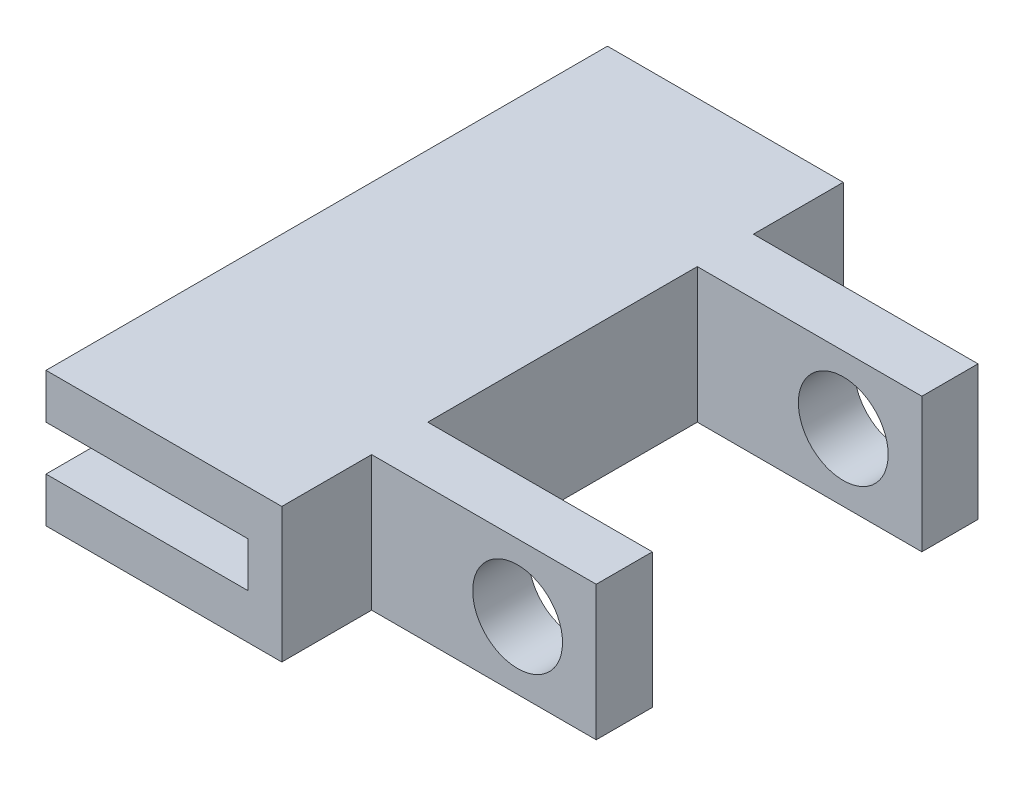
from build123d import *

# Parameters (mm, degrees)
EXTRUDE_1_DEPTH      = 25
EXTRUDE_1_DEPTH_BACK = 25
SKETCH_2_W           = 5
SKETCH_2_H           = 12
EXTRUDE_2_DEPTH      = 20
SKETCH_3_R           = 4
CUT_EXTRUDE_1_DEPTH  = 41


with BuildPart() as part:
    # 草图1 → 凸台-拉伸1 (new, two sides: drawn at the far end of the back side and taken through both)
    with BuildSketch(Plane.XY.offset(-EXTRUDE_1_DEPTH_BACK)):
        Polygon((-12.553319429, 0), (5.446680571, 0), (5.446680571, 4), (-12.553319429, 4), (-12.553319429, 8), (8.446680571, 8), (8.446680571, -4), (-12.553319429, -4), align=None)
    extrude(amount=EXTRUDE_1_DEPTH + EXTRUDE_1_DEPTH_BACK)

    # 草图2 → 凸台-拉伸2 (add)
    with BuildSketch(Plane(origin=(8.446680571, 0, 0), x_dir=(0, 0, -1), z_dir=(1, 0, 0))):
        with Locations((-14.5, 2)):
            Rectangle(SKETCH_2_W, SKETCH_2_H)
        with Locations((14.5, 2)):
            Rectangle(SKETCH_2_W, SKETCH_2_H)
    extrude(amount=EXTRUDE_2_DEPTH)

    # 草图3 → 切除-拉伸1 (cut)
    with BuildSketch(Plane.XY.offset(17)):
        with Locations((21.446680571, 2)):
            Circle(SKETCH_3_R)
    extrude(amount=-CUT_EXTRUDE_1_DEPTH, mode=Mode.SUBTRACT)


solid = part.part
